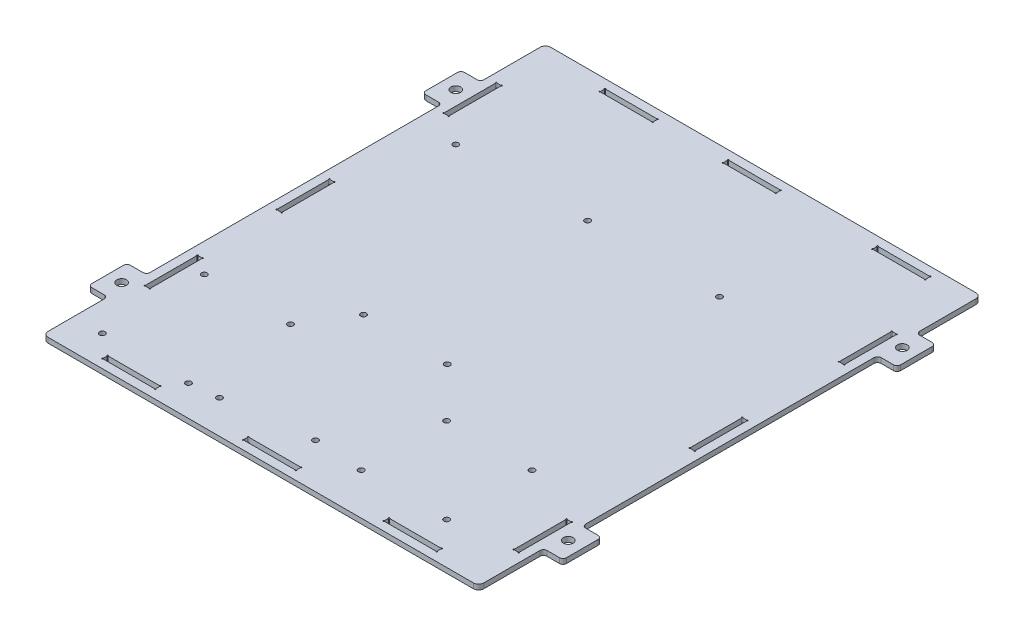
from build123d import *

# Parameters (mm, degrees)
SKETCH1_R           = 1.6
SKETCH1_R_2         = 2.75
BOSS_EXTRUDE1_DEPTH = 2.9


with BuildPart() as part:
    # Sketch1 → Boss-Extrude1 (new body)
    with BuildSketch(Plane(origin=(0, 0, 0), x_dir=(1, 0, 0), z_dir=(0, 1, 0))):
        with BuildLine():
            Line((-120.9, -142.9), (120.9, -142.9))
            ThreePointArc((120.9, -142.9), (123.021320344, -142.021320344), (123.9, -139.9))
            Line((123.9, -139.9), (123.9, -108))
            ThreePointArc((123.9, -108), (124.485786438, -106.585786438), (125.9, -106))
            Line((125.9, -106), (133, -106))
            ThreePointArc((133, -106), (134.414213562, -105.414213562), (135, -104))
            Line((135, -104), (135, -86))
            ThreePointArc((135, -86), (134.414213562, -84.585786438), (133, -84))
            Line((133, -84), (125.9, -84))
            ThreePointArc((125.9, -84), (124.485786438, -83.414213562), (123.9, -82))
            Line((123.9, -82), (123.9, 82))
            ThreePointArc((123.9, 82), (124.485786438, 83.414213562), (125.9, 84))
            Line((125.9, 84), (133, 84))
            ThreePointArc((133, 84), (134.414213562, 84.585786438), (135, 86))
            Line((135, 86), (135, 104))
            ThreePointArc((135, 104), (134.414213562, 105.414213562), (133, 106))
            Line((133, 106), (125.9, 106))
            ThreePointArc((125.9, 106), (124.485786438, 106.585786438), (123.9, 108))
            Line((123.9, 108), (123.9, 139.9))
            ThreePointArc((123.9, 139.9), (123.021320344, 142.021320344), (120.9, 142.9))
            Line((120.9, 142.9), (-120.9, 142.9))
            ThreePointArc((-120.9, 142.9), (-123.021320344, 142.021320344), (-123.9, 139.9))
            Line((-123.9, 139.9), (-123.9, 108))
            ThreePointArc((-123.9, 108), (-124.485786438, 106.585786438), (-125.9, 106))
            Line((-125.9, 106), (-133, 106))
            ThreePointArc((-133, 106), (-134.414213562, 105.414213562), (-135, 104))
            Line((-135, 104), (-135, 86))
            ThreePointArc((-135, 86), (-134.414213562, 84.585786438), (-133, 84))
            Line((-133, 84), (-125.9, 84))
            ThreePointArc((-125.9, 84), (-124.485786438, 83.414213562), (-123.9, 82))
            Line((-123.9, 82), (-123.9, -82))
            ThreePointArc((-123.9, -82), (-124.485786438, -83.414213562), (-125.9, -84))
            Line((-125.9, -84), (-133, -84))
            ThreePointArc((-133, -84), (-134.414213562, -84.585786438), (-135, -86))
            Line((-135, -86), (-135, -104))
            ThreePointArc((-135, -104), (-134.414213562, -105.414213562), (-133, -106))
            Line((-133, -106), (-125.9, -106))
            ThreePointArc((-125.9, -106), (-124.485786438, -106.585786438), (-123.9, -108))
            Line((-123.9, -108), (-123.9, -139.9))
            ThreePointArc((-123.9, -139.9), (-123.021320344, -142.021320344), (-120.9, -142.9))
        make_face()
        with Locations(Location((-107.5, -125.5, 0), (0, 0, 270))):
            Circle(SKETCH1_R, mode=Mode.SUBTRACT)
        with Locations(Location((-107.5, -67.5, 0), (0, 0, 270))):
            Circle(SKETCH1_R, mode=Mode.SUBTRACT)
        with Locations(Location((-58.5, -125.5, 0), (0, 0, 270))):
            Circle(SKETCH1_R, mode=Mode.SUBTRACT)
        with Locations(Location((-58.5, -67.5, 0), (0, 0, 270))):
            Circle(SKETCH1_R, mode=Mode.SUBTRACT)
        with Locations(Location((5.8, -42.64, 0), (0, 0, 270))):
            Circle(SKETCH1_R, mode=Mode.SUBTRACT)
        with Locations(Location((5.8, -117.57, 0), (0, 0, 270))):
            Circle(SKETCH1_R, mode=Mode.SUBTRACT)
        with Locations(Location((-42.46, -123.92, 0), (0, 0, 270))):
            Circle(SKETCH1_R, mode=Mode.SUBTRACT)
        with Locations(Location((-42.46, -42, 0), (0, 0, 270))):
            Circle(SKETCH1_R, mode=Mode.SUBTRACT)
        with Locations(Location((82.1, -70.7, 0), (0, 0, 270))):
            Circle(SKETCH1_R, mode=Mode.SUBTRACT)
        with Locations(Location((82.1, -119.3, 0), (0, 0, 270))):
            Circle(SKETCH1_R, mode=Mode.SUBTRACT)
        with Locations(Location((33.5, -70.7, 0), (0, 0, 270))):
            Circle(SKETCH1_R, mode=Mode.SUBTRACT)
        with Locations(Location((33.5, -119.3, 0), (0, 0, 270))):
            Circle(SKETCH1_R, mode=Mode.SUBTRACT)
        with Locations(Location((-100, 68, 0), (0, 0, 270))):
            Circle(SKETCH1_R, mode=Mode.SUBTRACT)
        with Locations(Location((-25, 68, 0), (0, 0, 270))):
            Circle(SKETCH1_R, mode=Mode.SUBTRACT)
        with Locations(Location((50, 68, 0), (0, 0, 270))):
            Circle(SKETCH1_R, mode=Mode.SUBTRACT)
        with Locations(Location((-127, -95, 0), (0, 0, 270))):
            Circle(SKETCH1_R_2, mode=Mode.SUBTRACT)
        with Locations(Location((-127, 95, 0), (0, 0, 270))):
            Circle(SKETCH1_R_2, mode=Mode.SUBTRACT)
        with Locations(Location((127, -95, 0), (0, 0, 270))):
            Circle(SKETCH1_R_2, mode=Mode.SUBTRACT)
        with Locations(Location((127, 95, 0), (0, 0, 270))):
            Circle(SKETCH1_R_2, mode=Mode.SUBTRACT)
        with BuildLine():
            Line((-94.6375, -137.9), (-65.3625, -137.9))
            ThreePointArc((-65.3625, -137.9), (-64.765012627, -138.147487373), (-65.0125, -137.55))
            Line((-65.0125, -137.55), (-65.0125, -135.35))
            ThreePointArc((-65.0125, -135.35), (-64.765012627, -134.752512627), (-65.3625, -135))
            Line((-65.3625, -135), (-94.6375, -135))
            ThreePointArc((-94.6375, -135), (-95.234987373, -134.752512627), (-94.9875, -135.35))
            Line((-94.9875, -135.35), (-94.9875, -137.55))
            ThreePointArc((-94.9875, -137.55), (-95.234987373, -138.147487373), (-94.6375, -137.9))
        make_face(mode=Mode.SUBTRACT)
        with BuildLine():
            Line((-14.6375, -137.9), (14.6375, -137.9))
            ThreePointArc((14.6375, -137.9), (15.234987373, -138.147487373), (14.9875, -137.55))
            Line((14.9875, -137.55), (14.9875, -135.35))
            ThreePointArc((14.9875, -135.35), (15.234987373, -134.752512627), (14.6375, -135))
            Line((14.6375, -135), (-14.6375, -135))
            ThreePointArc((-14.6375, -135), (-15.234987373, -134.752512627), (-14.9875, -135.35))
            Line((-14.9875, -135.35), (-14.9875, -137.55))
            ThreePointArc((-14.9875, -137.55), (-15.234987373, -138.147487373), (-14.6375, -137.9))
        make_face(mode=Mode.SUBTRACT)
        with BuildLine():
            Line((65.3625, -137.9), (94.6375, -137.9))
            ThreePointArc((94.6375, -137.9), (95.234987373, -138.147487373), (94.9875, -137.55))
            Line((94.9875, -137.55), (94.9875, -135.35))
            ThreePointArc((94.9875, -135.35), (95.234987373, -134.752512627), (94.6375, -135))
            Line((94.6375, -135), (65.3625, -135))
            ThreePointArc((65.3625, -135), (64.765012627, -134.752512627), (65.0125, -135.35))
            Line((65.0125, -135.35), (65.0125, -137.55))
            ThreePointArc((65.0125, -137.55), (64.765012627, -138.147487373), (65.3625, -137.9))
        make_face(mode=Mode.SUBTRACT)
        with BuildLine():
            Line((-84.6375, 135), (-55.3625, 135))
            ThreePointArc((-55.3625, 135), (-54.765012627, 134.752512627), (-55.0125, 135.35))
            Line((-55.0125, 135.35), (-55.0125, 137.55))
            ThreePointArc((-55.0125, 137.55), (-54.765012627, 138.147487373), (-55.3625, 137.9))
            Line((-55.3625, 137.9), (-84.6375, 137.9))
            ThreePointArc((-84.6375, 137.9), (-85.234987373, 138.147487373), (-84.9875, 137.55))
            Line((-84.9875, 137.55), (-84.9875, 135.35))
            ThreePointArc((-84.9875, 135.35), (-85.234987373, 134.752512627), (-84.6375, 135))
        make_face(mode=Mode.SUBTRACT)
        with BuildLine():
            Line((-14.6375, 135), (14.6375, 135))
            ThreePointArc((14.6375, 135), (15.234987373, 134.752512627), (14.9875, 135.35))
            Line((14.9875, 135.35), (14.9875, 137.55))
            ThreePointArc((14.9875, 137.55), (15.234987373, 138.147487373), (14.6375, 137.9))
            Line((14.6375, 137.9), (-14.6375, 137.9))
            ThreePointArc((-14.6375, 137.9), (-15.234987373, 138.147487373), (-14.9875, 137.55))
            Line((-14.9875, 137.55), (-14.9875, 135.35))
            ThreePointArc((-14.9875, 135.35), (-15.234987373, 134.752512627), (-14.6375, 135))
        make_face(mode=Mode.SUBTRACT)
        with BuildLine():
            Line((70.3625, 135), (99.6375, 135))
            ThreePointArc((99.6375, 135), (100.234987373, 134.752512627), (99.9875, 135.35))
            Line((99.9875, 135.35), (99.9875, 137.55))
            ThreePointArc((99.9875, 137.55), (100.234987373, 138.147487373), (99.6375, 137.9))
            Line((99.6375, 137.9), (70.3625, 137.9))
            ThreePointArc((70.3625, 137.9), (69.765012627, 138.147487373), (70.0125, 137.55))
            Line((70.0125, 137.55), (70.0125, 135.35))
            ThreePointArc((70.0125, 135.35), (69.765012627, 134.752512627), (70.3625, 135))
        make_face(mode=Mode.SUBTRACT)
        with BuildLine():
            Line((116.35, -114.9875), (118.55, -114.9875))
            ThreePointArc((118.55, -114.9875), (119.147487373, -115.234987373), (118.9, -114.6375))
            Line((118.9, -114.6375), (118.9, -85.3625))
            ThreePointArc((118.9, -85.3625), (119.147487373, -84.765012627), (118.55, -85.0125))
            Line((118.55, -85.0125), (116.35, -85.0125))
            ThreePointArc((116.35, -85.0125), (115.752512627, -84.765012627), (116, -85.3625))
            Line((116, -85.3625), (116, -114.6375))
            ThreePointArc((116, -114.6375), (115.752512627, -115.234987373), (116.35, -114.9875))
        make_face(mode=Mode.SUBTRACT)
        with BuildLine():
            Line((116.35, -14.9875), (118.55, -14.9875))
            ThreePointArc((118.55, -14.9875), (119.147487373, -15.234987373), (118.9, -14.6375))
            Line((118.9, -14.6375), (118.9, 14.6375))
            ThreePointArc((118.9, 14.6375), (119.147487373, 15.234987373), (118.55, 14.9875))
            Line((118.55, 14.9875), (116.35, 14.9875))
            ThreePointArc((116.35, 14.9875), (115.752512627, 15.234987373), (116, 14.6375))
            Line((116, 14.6375), (116, -14.6375))
            ThreePointArc((116, -14.6375), (115.752512627, -15.234987373), (116.35, -14.9875))
        make_face(mode=Mode.SUBTRACT)
        with BuildLine():
            Line((116.35, 70.0125), (118.55, 70.0125))
            ThreePointArc((118.55, 70.0125), (119.147487373, 69.765012627), (118.9, 70.3625))
            Line((118.9, 70.3625), (118.9, 99.6375))
            ThreePointArc((118.9, 99.6375), (119.147487373, 100.234987373), (118.55, 99.9875))
            Line((118.55, 99.9875), (116.35, 99.9875))
            ThreePointArc((116.35, 99.9875), (115.752512627, 100.234987373), (116, 99.6375))
            Line((116, 99.6375), (116, 70.3625))
            ThreePointArc((116, 70.3625), (115.752512627, 69.765012627), (116.35, 70.0125))
        make_face(mode=Mode.SUBTRACT)
        with BuildLine():
            Line((-118.55, -89.9875), (-116.35, -89.9875))
            ThreePointArc((-116.35, -89.9875), (-115.752512627, -90.234987373), (-116, -89.6375))
            Line((-116, -89.6375), (-116, -60.3625))
            ThreePointArc((-116, -60.3625), (-115.752512627, -59.765012627), (-116.35, -60.0125))
            Line((-116.35, -60.0125), (-118.55, -60.0125))
            ThreePointArc((-118.55, -60.0125), (-119.147487373, -59.765012627), (-118.9, -60.3625))
            Line((-118.9, -60.3625), (-118.9, -89.6375))
            ThreePointArc((-118.9, -89.6375), (-119.147487373, -90.234987373), (-118.55, -89.9875))
        make_face(mode=Mode.SUBTRACT)
        with BuildLine():
            Line((-118.55, -14.9875), (-116.35, -14.9875))
            ThreePointArc((-116.35, -14.9875), (-115.752512627, -15.234987373), (-116, -14.6375))
            Line((-116, -14.6375), (-116, 14.6375))
            ThreePointArc((-116, 14.6375), (-115.752512627, 15.234987373), (-116.35, 14.9875))
            Line((-116.35, 14.9875), (-118.55, 14.9875))
            ThreePointArc((-118.55, 14.9875), (-119.147487373, 15.234987373), (-118.9, 14.6375))
            Line((-118.9, 14.6375), (-118.9, -14.6375))
            ThreePointArc((-118.9, -14.6375), (-119.147487373, -15.234987373), (-118.55, -14.9875))
        make_face(mode=Mode.SUBTRACT)
        with BuildLine():
            Line((-118.55, 80.0125), (-116.35, 80.0125))
            ThreePointArc((-116.35, 80.0125), (-115.752512627, 79.765012627), (-116, 80.3625))
            Line((-116, 80.3625), (-116, 109.6375))
            ThreePointArc((-116, 109.6375), (-115.752512627, 110.234987373), (-116.35, 109.9875))
            Line((-116.35, 109.9875), (-118.55, 109.9875))
            ThreePointArc((-118.55, 109.9875), (-119.147487373, 110.234987373), (-118.9, 109.6375))
            Line((-118.9, 109.6375), (-118.9, 80.3625))
            ThreePointArc((-118.9, 80.3625), (-119.147487373, 79.765012627), (-118.55, 80.0125))
        make_face(mode=Mode.SUBTRACT)
    extrude(amount=BOSS_EXTRUDE1_DEPTH)


solid = part.part
